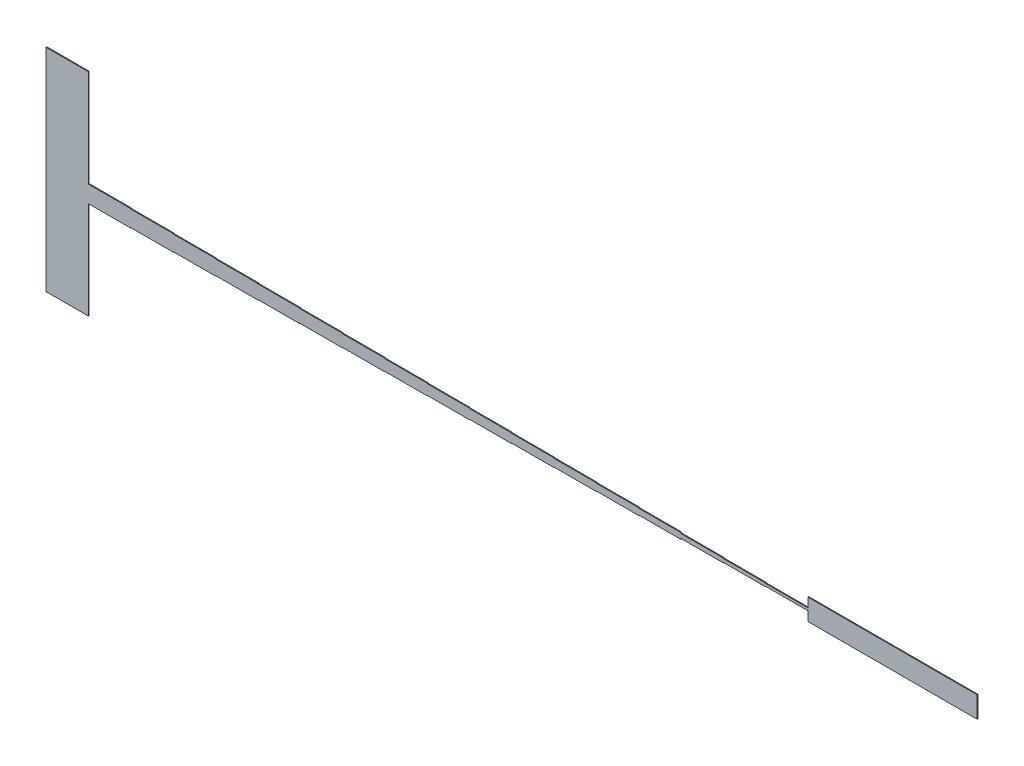
from build123d import *

# Parameters (mm, degrees)
BOSS_EXTRUDE1_DEPTH = 20
SKETCH2_W           = 1000
SKETCH2_H           = 2250
CUT_EXTRUDE1_DEPTH  = 41077.153666087
CUT_EXTRUDE3_DEPTH  = 41077.153666087
SKETCH4_W           = 20000
SKETCH4_H           = 500
CUT_EXTRUDE4_DEPTH  = 41077.153666087


with BuildPart() as part:
    # Sketch1 → Boss-Extrude1 (new body)
    with BuildSketch(Plane.XY):
        Polygon((1000, 250), (41000, 250), (41000, -250), (1000, -250), (1000, -2500), (-1000, -2500), (-1000, 2500), (1000, 2500), align=None)
    extrude(amount=-BOSS_EXTRUDE1_DEPTH)

    # Sketch2 → Cut-Extrude1 (cut, through all)
    with BuildSketch(Plane.XY):
        with Locations((500, 1375)):
            Rectangle(SKETCH2_W, SKETCH2_H)
        with Locations((500, -1375)):
            Rectangle(SKETCH2_W, SKETCH2_H)
    extrude(amount=-CUT_EXTRUDE1_DEPTH, mode=Mode.SUBTRACT)

    # Sketch3 → Cut-Extrude3 (cut, through all)
    with BuildSketch(Plane.XY):
        Polygon((0, 250), (0, 200), (1000, 200), (1000, 190), (2000, 190), (2000, 180), (3000, 180), (3000, 170), (4000, 170), (4000, 160), (5000, 160), (5000, 150), (6000, 150), (6000, 140), (7000, 140), (7000, 130), (8000, 130), (8000, 120), (9000, 120), (9000, 110), (10000, 110), (10000, 100), (11000, 100), (11000, 90), (12000, 90), (12000, 80), (13000, 80), (13000, 70), (14000, 70), (14000, 50), (15000, 50), (15000, 40), (16000, 40), (16000, 30), (17000, 30), (17000, 250), align=None)
    cut_extrude3 = extrude(amount=-CUT_EXTRUDE3_DEPTH, mode=Mode.SUBTRACT)

    # Mirror1: Cut-Extrude3 across plane
    add(cut_extrude3.mirror(Plane.ZX), mode=Mode.SUBTRACT)

    # Sketch4 → Cut-Extrude4 (cut, through all)
    with BuildSketch(Plane.XY):
        with Locations((31000, 0)):
            Rectangle(SKETCH4_W, SKETCH4_H)
    extrude(amount=-CUT_EXTRUDE4_DEPTH, mode=Mode.SUBTRACT)


solid = part.part
